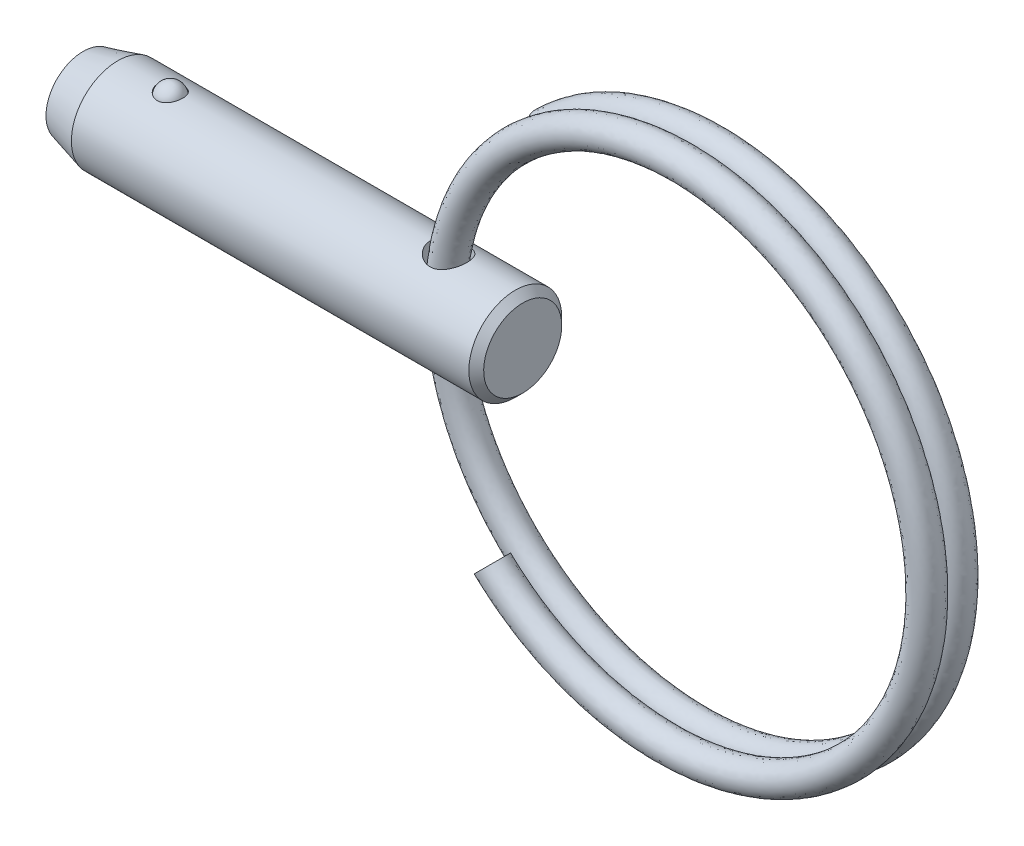
from build123d import *

# Parameters (mm, degrees)
SKETCH4_W          = 0.9525
SKETCH4_H          = 4.7625
SWEEP1_PITCH       = 1.5494
SWEEP1_HEIGHT      = 1.355725
SWEEP1_RADIUS      = 13.462
SKETCH6_R          = 0.762
SWEEP2_PITCH       = 1.5494
SWEEP2_HEIGHT      = 1.355725
SWEEP2_RADIUS      = 13.462
SWEEP2_START_ANGLE = -180
SKETCH6_2_R        = 0.762


with BuildPart() as part:
    # Sketch1 → Revolve1 (revolve)
    with BuildSketch(Plane.XY, mode=Mode.PRIVATE) as revolve1_sk:
        Polygon((11.2649, 2.00025), (10.8839, 2.38125), (-9.487510803, 2.38125), (-11.2649, 1.905), (-11.2649, 0), (11.2649, 0), align=None)
    revolve(revolve1_sk.sketch.rotate(Axis((11.2649, 0, 0), (1, 0, 0)), 180), axis=Axis((11.2649, 0, 0), (1, 0, 0)))

    # Sketch2 → Cut-Revolve1 (revolve, cut)
    with BuildSketch(Plane.XY):
        with BuildLine():
            Line((-6.114844331, 2.143125), (-7.480094331, 2.143125))
            ThreePointArc((-7.480094331, 2.143125), (-6.797469331, 2.82575), (-6.114844331, 2.143125))
        make_face()
    revolve(axis=Axis((-6.114844331, 2.143125, 0), (1, 0, 0)), mode=Mode.SUBTRACT)

    # Sketch4 → Cut-Revolve2 (revolve, cut)
    with BuildSketch(Plane.XY, mode=Mode.PRIVATE) as cut_revolve2_sk:
        with Locations((7.94385, 0)):
            Rectangle(SKETCH4_W, SKETCH4_H)
    revolve(cut_revolve2_sk.sketch.rotate(Axis((7.4676, -2.38125, 0), (0, 1, 0)), 180), axis=Axis((7.4676, -2.38125, 0), (0, 1, 0)), mode=Mode.SUBTRACT)


with BuildPart() as body_2:
    # Sketch3 → Revolve2 (revolve)
    with BuildSketch(Plane.XY):
        with BuildLine():
            Line((-6.140244331, 2.143125), (-7.454694331, 2.143125))
            ThreePointArc((-7.454694331, 2.143125), (-6.797469331, 2.80035), (-6.140244331, 2.143125))
        make_face()
    revolve(axis=Axis((-6.140244331, 2.143125, 0), (1, 0, 0)))


with BuildPart() as body_3:
    # Sweep1: sweep along a helix
    with BuildLine() as sweep1_path:
        Helix(SWEEP1_PITCH, SWEEP1_HEIGHT, SWEEP1_RADIUS, center=(20.047648906, 0, 0), direction=(0, 0, -1), lefthand=True)
    # Sketch6 → Sweep1 (sweep)
    with BuildSketch(Plane(origin=(114.003847968, 0, 0), x_dir=(0, 0, -1), z_dir=(0, 1, 0))):
        with Locations((0, 106.656199061)):
            Circle(SKETCH6_R)
    sweep(path=sweep1_path.line, is_frenet=True)

    # Sweep2: sweep along a helix
    with BuildLine() as sweep2_path:
        add(Helix(SWEEP2_PITCH, SWEEP2_HEIGHT, SWEEP2_RADIUS, center=(20.047648906, 0, 0), direction=(0, 0, 1), lefthand=True, mode=Mode.PRIVATE).rotate(Axis((20.047648906, 0, 0), (0, 0, 1)), SWEEP2_START_ANGLE))
    # Sketch6<2> → Sweep2 (sweep)
    with BuildSketch(Plane(origin=(114.003847968, 0, 0), x_dir=(0, 0, -1), z_dir=(0, 1, 0))):
        with Locations((0, 106.656199061)):
            Circle(SKETCH6_2_R)
    sweep(path=sweep2_path.line, is_frenet=True)


solid = Compound([part.part, body_2.part, body_3.part])
